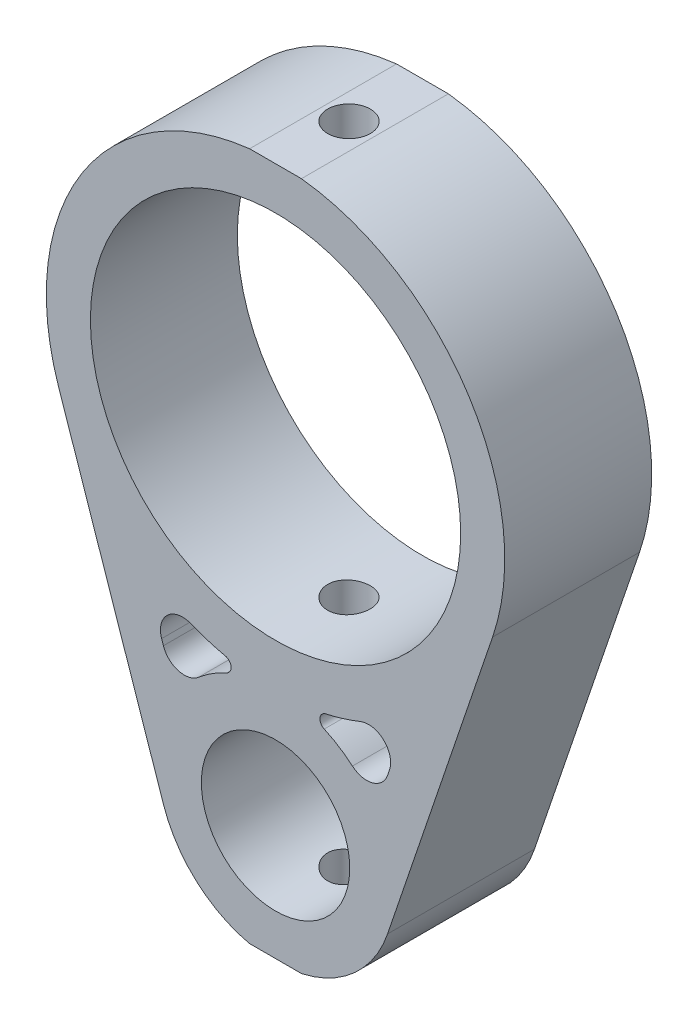
from build123d import *

# Parameters (mm, degrees)
SKETCH_1_R               = 12.6
SKETCH_1_R_2             = 5.05
EXTRUDE_1_DEPTH          = 10
EXTRUDE_START            = -10
EXTRUDE_2_DEPTH          = 10
CUT_EXTRUDE_1_DEPTH      = 37.589103569
CUT_EXTRUDE_1_DEPTH_BACK = 37.589103569
SKETCH_3_R               = 1.45
CUT_EXTRUDE_2_DEPTH      = 37.589103725
CUT_EXTRUDE_2_DEPTH_BACK = 37.589103725
SKETCH_4_W               = 93.892826014
SKETCH_4_H               = 80.433232648
SKETCH_4_W_2             = 43.077359666
SKETCH_4_H_2             = 46.85


with BuildPart() as part:
    # 草图1 → 凸台-拉伸1 (new body)
    with BuildSketch(Plane.XY):
        with BuildLine():
            Line((-1.414911685, -15.535701623), (-1.414911685, -15.575321778))
            ThreePointArc((-1.414911685, -15.575321778), (0.005842023, -31.54999788), (1.403408047, -15.573276474))
            Line((1.403408047, -15.573276474), (1.403408047, -15.536745021))
            ThreePointArc((1.403408047, -15.536745021), (0.00577543, 15.599998931), (-1.414911685, -15.535701623))
        make_face()
        Circle(SKETCH_1_R, mode=Mode.SUBTRACT)
        with Locations((0, -23.5)):
            Circle(SKETCH_1_R_2, mode=Mode.SUBTRACT)
    extrude(amount=EXTRUDE_1_DEPTH)

    # 草图2 → 凸台-拉伸2 (add)
    with BuildSketch(Plane.XY.offset(10).offset(EXTRUDE_START)):
        Polygon((-14.77297225, -5.011914894), (-7.623232475, -26.086276596), (-5.929048094, -20.254331983), (0, -17.39919484), (5.929048094, -20.254331983), (7.623232475, -26.086276596), (14.77297225, -5.011914894), (5.311228847, -13.252346959), (0, -13.517472928), (-5.311228847, -13.252346959), align=None)
        with BuildLine():
            Line((-7.752949676, -16.366177664), (-7.630606655, -16.726792335))
            ThreePointArc((-7.630606655, -16.726792335), (-6.60716899, -17.691376281), (-5.234715693, -17.384425487))
            ThreePointArc((-5.234715693, -17.384425487), (-4.31764561, -16.705852785), (-3.31386093, -16.163732166))
            ThreePointArc((-3.31386093, -16.163732166), (-3.025346815, -15.633069871), (-3.458264207, -15.211850929))
            Line((-3.458264207, -15.211850929), (-4.103625329, -15.050589994))
            ThreePointArc((-4.103625329, -15.050589994), (-4.948227887, -14.794426004), (-5.776991612, -14.490906387))
            ThreePointArc((-5.776991612, -14.490906387), (-7.36504895, -14.796244404), (-7.752949676, -16.366177664))
        make_face(mode=Mode.SUBTRACT)
        with BuildLine():
            Line((4.103625329, -15.050589994), (3.458264207, -15.211850929))
            ThreePointArc((3.458264207, -15.211850929), (3.025346815, -15.633069871), (3.31386093, -16.163732166))
            ThreePointArc((3.31386093, -16.163732166), (4.31764561, -16.705852785), (5.234715693, -17.384425487))
            ThreePointArc((5.234715693, -17.384425487), (6.60716899, -17.691376281), (7.630606655, -16.726792335))
            Line((7.630606655, -16.726792335), (7.752949676, -16.366177664))
            ThreePointArc((7.752949676, -16.366177664), (7.36504895, -14.796244404), (5.776991612, -14.490906387))
            ThreePointArc((5.776991612, -14.490906387), (4.948227887, -14.794426004), (4.103625329, -15.050589994))
        make_face(mode=Mode.SUBTRACT)
    extrude(amount=EXTRUDE_2_DEPTH)

    # 草图3 → 切除-拉伸1 (cut, two sides: drawn at the far end of the back side and taken through both)
    with BuildSketch(Plane(origin=(0, 0, 0), x_dir=(1, 0, 0), z_dir=(0, 1, 0)).offset(-CUT_EXTRUDE_1_DEPTH_BACK)):
        with Locations(Location((0, -5, 0), (0, 0, 270))):
            Circle(SKETCH_3_R)
    extrude(amount=CUT_EXTRUDE_1_DEPTH + CUT_EXTRUDE_1_DEPTH_BACK, mode=Mode.SUBTRACT)

    # 草图4 → 切除-拉伸2 (cut, two sides: drawn at the far end of the back side and taken through both)
    with BuildSketch(Plane.XY.offset(10).offset(-CUT_EXTRUDE_2_DEPTH_BACK)):
        with Locations((-5.954078533, 0.891401237)):
            Rectangle(SKETCH_4_W, SKETCH_4_H)
        with Locations((3.186246386, -7.925)):
            Rectangle(SKETCH_4_W_2, SKETCH_4_H_2, mode=Mode.SUBTRACT)
    extrude(amount=CUT_EXTRUDE_2_DEPTH + CUT_EXTRUDE_2_DEPTH_BACK, mode=Mode.SUBTRACT)


solid = part.part
